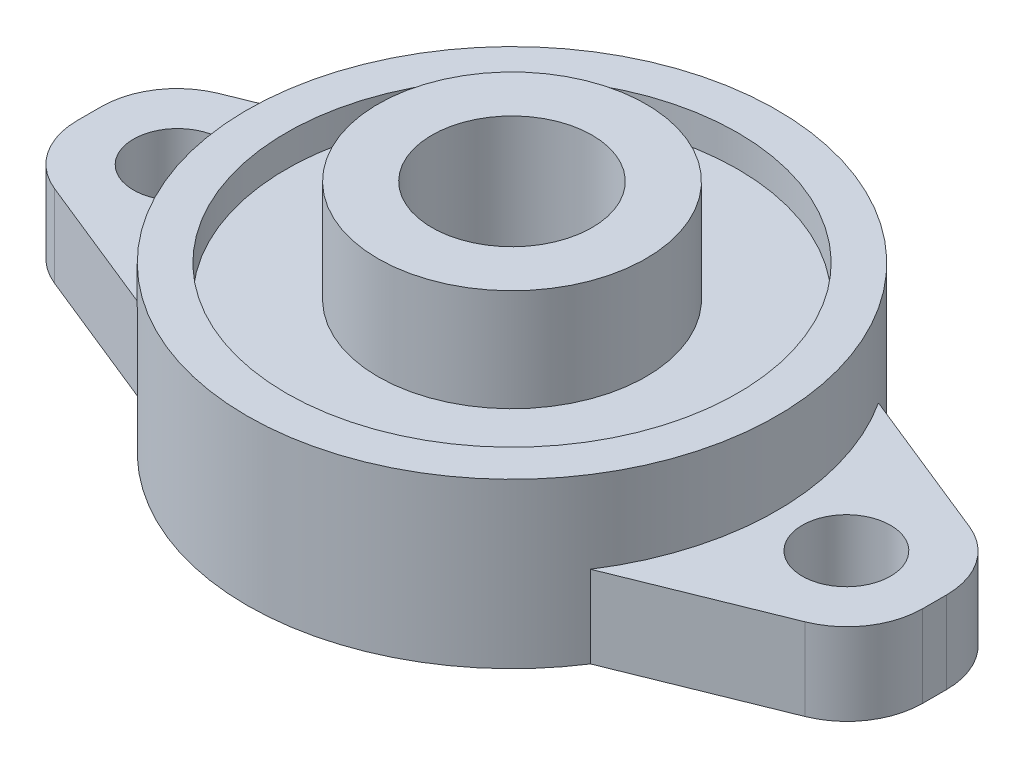
from build123d import *
from build123d.topology import SkipClean

# Parameters (mm, degrees)
SKETCH1_R           = 3.5
SKETCH1_R_2         = 21.000776116
SKETCH1_R_3         = 6.35
BOSS_EXTRUDE1_DEPTH = 6.5
SKETCH2_R           = 21.000776116
SKETCH2_R_2         = 17.885901882
BOSS_EXTRUDE2_DEPTH = 6.5
SKETCH3_R           = 10.618204783
SKETCH3_R_2         = 6.35
BOSS_EXTRUDE3_DEPTH = 12.1
SKETCH4_R           = 17.885901882
SKETCH4_R_2         = 10.618204783
BOSS_EXTRUDE5_DEPTH = 4
FILLET1_R           = 6


with BuildPart() as part:
    # Sketch1 → Boss-Extrude1 (new body)
    # profile 1 of 3: a face of its own
    with BuildSketch(Plane(origin=(0, 0, 0), x_dir=(1, 0, 0), z_dir=(0, 1, 0))):
        with BuildLine():
            Line((-33.5, 5), (-33.5, 0))
            Line((-33.5, 0), (-33.5, -5))
            Line((-33.5, -5), (-17.629397896, -11.41213947))
            ThreePointArc((-17.629397896, -11.41213947), (-21.000776116, 0), (-17.629397896, 11.41213947))
            Line((-17.629397896, 11.41213947), (-33.5, 5))
        make_face()
        with Locations(Location((-26.5, 0, 0), (0, 0, 90))):
            Circle(SKETCH1_R, mode=Mode.SUBTRACT)
    # profile 2 of 3: a face of its own
    with BuildSketch(Plane(origin=(0, 0, 0), x_dir=(1, 0, 0), z_dir=(0, 1, 0))):
        Circle(SKETCH1_R_2)
        with Locations(Location((0, 0, 0), (0, 0, 90))):
            Circle(SKETCH1_R_3, mode=Mode.SUBTRACT)
    # profile 3 of 3: a face of its own
    with BuildSketch(Plane(origin=(0, 0, 0), x_dir=(1, 0, 0), z_dir=(0, 1, 0))):
        with BuildLine():
            Line((33.5, 5), (17.629397896, 11.41213947))
            ThreePointArc((17.629397896, 11.41213947), (20.140303321, 5.949855426), (21.000776116, 0))
            ThreePointArc((21.000776116, 0), (20.140303321, -5.949855426), (17.629397896, -11.41213947))
            Line((17.629397896, -11.41213947), (33.5, -5))
            Line((33.5, -5), (33.5, 0))
            Line((33.5, 0), (33.5, 5))
        make_face()
        with Locations(Location((26.5, 0, 0), (0, 0, 90))):
            Circle(SKETCH1_R, mode=Mode.SUBTRACT)
    extrude(amount=BOSS_EXTRUDE1_DEPTH)

    # Sketch2 → Boss-Extrude2 (add)
    with BuildSketch(Plane(origin=(0, 6.5, 0), x_dir=(1, 0, 0), z_dir=(0, 1, 0))):
        with Locations(Location((0, 0, 0), (0, 0, 32.916425521))):
            Circle(SKETCH2_R)
        with Locations(Location((0, 0, 0), (0, 0, 90))):
            Circle(SKETCH2_R_2, mode=Mode.SUBTRACT)
    extrude(amount=BOSS_EXTRUDE2_DEPTH)

    # Sketch3 → Boss-Extrude3 (add)
    with SkipClean():  # the faces are left unmerged after this step: merging them gives an invalid solid
        with BuildSketch(Plane(origin=(0, 6.5, 0), x_dir=(1, 0, 0), z_dir=(0, 1, 0))):
            with Locations(Location((0, 0, 0), (0, 0, 270))):
                Circle(SKETCH3_R)
            with Locations(Location((0, 0, 0), (0, 0, 90))):
                Circle(SKETCH3_R_2, mode=Mode.SUBTRACT)
        extrude(amount=BOSS_EXTRUDE3_DEPTH)

    # Sketch4 → Boss-Extrude5 (add)
    with SkipClean():  # the faces are left unmerged after this step: merging them gives an invalid solid
        with BuildSketch(Plane(origin=(0, 6.5, 0), x_dir=(1, 0, 0), z_dir=(0, 1, 0))):
            with Locations(Location((0, 0, 0), (0, 0, 90))):
                Circle(SKETCH4_R)
            with Locations(Location((0, 0, 0), (0, 0, 270))):
                Circle(SKETCH4_R_2, mode=Mode.SUBTRACT)
        extrude(amount=BOSS_EXTRUDE5_DEPTH)

    # Fillet1
    fillet1_edges = [part.edges().sort_by_distance(p)[0] for p in [
        (33.5, 3.25, 5),
        (33.5, 3.25, -5),
        (-33.5, 3.25, 5),
        (-33.5, 3.25, -5),
    ]]
    fillet(fillet1_edges, radius=FILLET1_R)


solid = part.part
